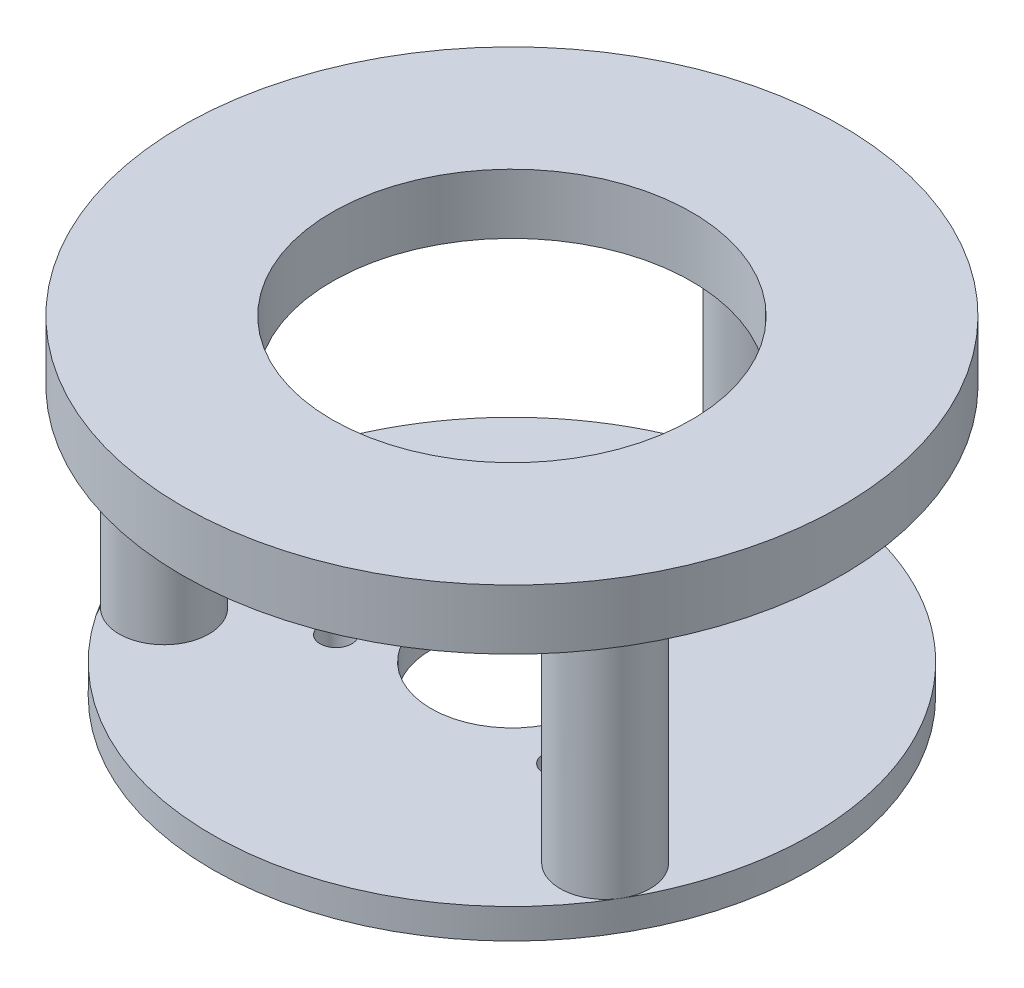
from build123d import *

# Parameters (mm, degrees)
SKETCH1_R           = 50
SKETCH1_R_2         = 13.5
SKETCH1_R_3         = 2.65
SKETCH1_R_4         = 1.65
BOSS_EXTRUDE1_DEPTH = 5
SKETCH3_R           = 7.5
BOSS_EXTRUDE2_DEPTH = 40
SKETCH4_R           = 55
SKETCH4_R_2         = 30
BOSS_EXTRUDE3_DEPTH = 10
CUT_EXTRUDE1_DEPTH  = 3.5


with BuildPart() as part:
    # Sketch1 → Boss-Extrude1 (new body)
    with BuildSketch(Plane(origin=(0, 0, 0), x_dir=(1, 0, 0), z_dir=(0, 1, 0))):
        with Locations(Location((0, 0, 0), (0, 0, 270))):
            Circle(SKETCH1_R)
        with Locations(Location((0, 0, 0), (0, 0, 270))):
            Circle(SKETCH1_R_2, mode=Mode.SUBTRACT)
        with Locations(Location((0, 21.5, 0), (0, 0, 270))):
            Circle(SKETCH1_R_3, mode=Mode.SUBTRACT)
        with Locations(Location((23.0125, 0, 0), (0, 0, 270))):
            Circle(SKETCH1_R_4, mode=Mode.SUBTRACT)
        with Locations(Location((-23.0125, 0, 0), (0, 0, 270))):
            Circle(SKETCH1_R_4, mode=Mode.SUBTRACT)
        with Locations(Location((18.619546181, -10.75, 0), (0, 0, 270))):
            Circle(SKETCH1_R_3, mode=Mode.SUBTRACT)
        with Locations(Location((-18.619546181, -10.75, 0), (0, 0, 270))):
            Circle(SKETCH1_R_3, mode=Mode.SUBTRACT)
    extrude(amount=BOSS_EXTRUDE1_DEPTH)

    # Sketch3 → Boss-Extrude2 (add)
    with BuildSketch(Plane(origin=(0, 5, 0), x_dir=(1, 0, 0), z_dir=(0, 1, 0))):
        with Locations(Location((0, 42.5, 0), (0, 0, 89.99967908))):
            Circle(SKETCH3_R)
        with Locations(Location((36.806079661, -21.25, 0), (0, 0, 329.999669783))):
            Circle(SKETCH3_R)
        with Locations(Location((-36.806079661, -21.25, 0), (0, 0, 209.999673972))):
            Circle(SKETCH3_R)
    extrude(amount=BOSS_EXTRUDE2_DEPTH)

    # Sketch4 → Boss-Extrude3 (add)
    with BuildSketch(Plane(origin=(0, 45, 0), x_dir=(1, 0, 0), z_dir=(0, 1, 0))):
        with Locations(Location((0, 0, 0), (0, 0, 270))):
            Circle(SKETCH4_R)
        with Locations(Location((0, 0, 0), (0, 0, 270))):
            Circle(SKETCH4_R_2, mode=Mode.SUBTRACT)
    extrude(amount=BOSS_EXTRUDE3_DEPTH)

    # Sketch5 → Cut-Extrude1 (cut)
    with BuildSketch(Plane(origin=(0, 0, 0), x_dir=(-1, 0, 0), z_dir=(0, -1, 0))):
        Polygon((-26.476601615, 0), (-24.744550808, -3), (-21.280449192, -3), (-19.548398385, 0), (-21.280449192, 3), (-24.744550808, 3), align=None)
        Polygon((26.476601615, 0), (24.744550808, 3), (21.280449192, 3), (19.548398385, 0), (21.280449192, -3), (24.744550808, -3), align=None)
    extrude(amount=-CUT_EXTRUDE1_DEPTH, mode=Mode.SUBTRACT)


solid = part.part
